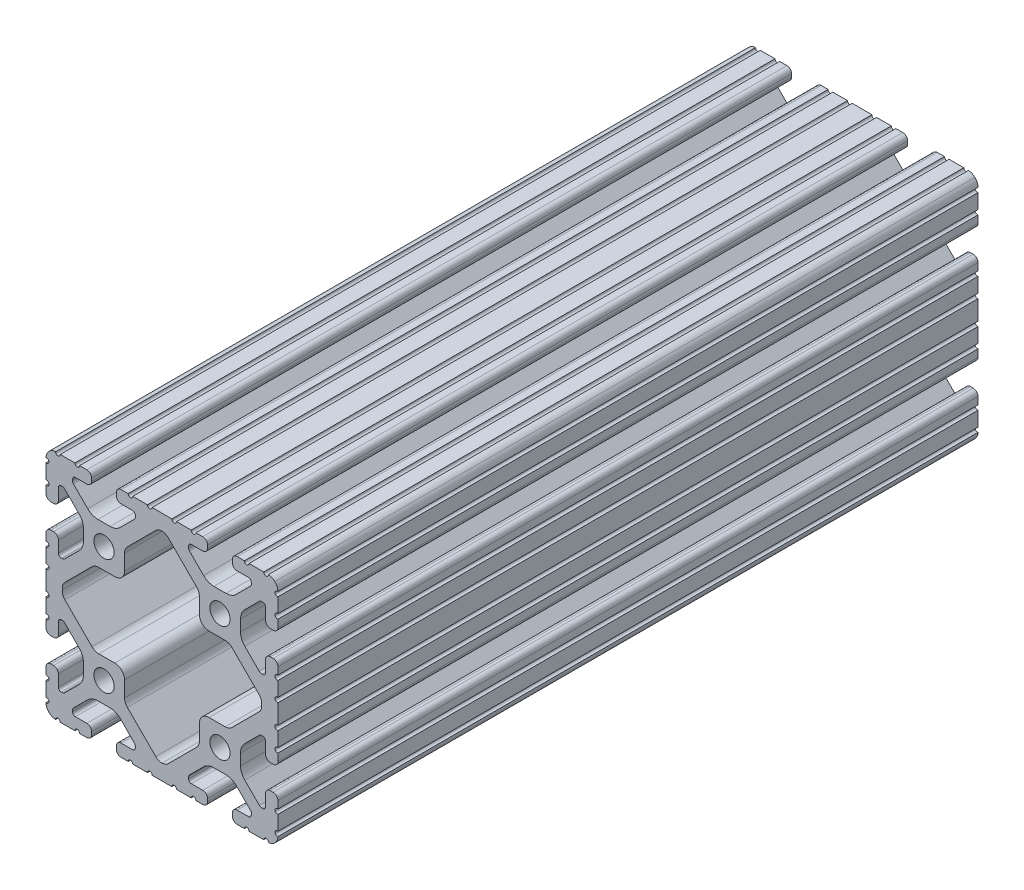
from build123d import *

# Parameters (mm, degrees)
BOSS_EXTRUDE1_DEPTH      = 115
BOSS_EXTRUDE1_DEPTH_BACK = 115
SKETCH3_R                = 3.3274


with BuildPart() as part:
    # Sketch3 → Boss-Extrude1 (new, two sides: drawn at the far end of the back side and taken through both)
    with BuildSketch(Plane.XY.offset(-BOSS_EXTRUDE1_DEPTH_BACK)):
        with BuildLine():
            Line((34.036, 28.448), (34.036, 24.630196049))
            ThreePointArc((34.036, 24.630196049), (34.497248241, 23.51664429), (35.6108, 23.055396049))
            Line((35.6108, 23.055396049), (36.525200183, 23.055396049))
            ThreePointArc((36.525200183, 23.055396049), (37.638751813, 23.516644236), (38.1, 24.630195866))
            Line((38.1, 24.630195866), (38.1, 27.023826138))
            ThreePointArc((38.1, 27.023826138), (37.117780706, 27.7845421), (38.1, 28.545258062))
            Line((38.1, 28.545258062), (38.1, 33.373016026))
            ThreePointArc((38.1, 33.373016026), (37.141472621, 34.109236774), (38.1, 34.845457521))
            ThreePointArc((38.1, 34.845457521), (37.837757813, 36.120195002), (37.086123144, 37.182631793))
            ThreePointArc((37.086123144, 37.182631793), (36.106286572, 37.843374398), (34.952681874, 38.1))
            ThreePointArc((34.952681874, 38.1), (34.190730434, 37.320215335), (33.428778994, 38.1))
            Line((33.428778994, 38.1), (28.601105935, 38.1))
            ThreePointArc((28.601105935, 38.1), (27.839158581, 37.32021942), (27.077211227, 38.1))
            Line((27.077211227, 38.1), (24.6888, 38.1))
            ThreePointArc((24.6888, 38.1), (23.575248241, 37.638751759), (23.114, 36.5252))
            Line((23.114, 36.5252), (23.114, 35.6108))
            ThreePointArc((23.114, 35.6108), (23.575248241, 34.497248241), (24.6888, 34.036))
            Line((24.6888, 34.036), (28.448, 34.036))
            ThreePointArc((28.448, 34.036), (29.076617928, 33.775617928), (29.337, 33.147))
            Line((29.337, 33.147), (29.337, 32.720693454))
            ThreePointArc((29.337, 32.720693454), (29.326675076, 32.273872751), (29.100231244, 31.888543625))
            Line((29.100231244, 31.888543625), (24.409287499, 27.197588341))
            ThreePointArc((24.409287499, 27.197588341), (22.868340045, 26.167958114), (21.050667579, 25.8064))
            Line((21.050667579, 25.8064), (17.049332421, 25.8064))
            ThreePointArc((17.049332421, 25.8064), (15.231659955, 26.167958114), (13.690712501, 27.197588341))
            Line((13.690712501, 27.197588341), (9.023381298, 31.864931024))
            ThreePointArc((9.023381298, 31.864931024), (8.830670886, 32.153343113), (8.763, 32.493548179))
            Line((8.763, 32.493548179), (8.763, 33.147))
            ThreePointArc((8.763, 33.147), (9.023382072, 33.775617928), (9.652, 34.036))
            Line((9.652, 34.036), (13.4112, 34.036))
            ThreePointArc((13.4112, 34.036), (14.524751759, 34.497248241), (14.986, 35.6108))
            Line((14.986, 35.6108), (14.986, 36.5252))
            ThreePointArc((14.986, 36.5252), (14.524751759, 37.638751759), (13.4112, 38.1))
            Line((13.4112, 38.1), (11.128867074, 38.1))
            ThreePointArc((11.128867074, 38.1), (10.367071033, 37.320370693), (9.605274992, 38.1))
            Line((9.605274992, 38.1), (4.777313069, 38.1))
            ThreePointArc((4.777313069, 38.1), (4.015517029, 37.320370693), (3.253720988, 38.1))
            Line((3.253720988, 38.1), (-3.253720988, 38.1))
            ThreePointArc((-3.253720988, 38.1), (-4.015517029, 37.320370693), (-4.777313069, 38.1))
            Line((-4.777313069, 38.1), (-9.605274992, 38.1))
            ThreePointArc((-9.605274992, 38.1), (-10.367071033, 37.320370693), (-11.128867074, 38.1))
            Line((-11.128867074, 38.1), (-13.4112, 38.1))
            ThreePointArc((-13.4112, 38.1), (-14.524751759, 37.638751759), (-14.986, 36.5252))
            Line((-14.986, 36.5252), (-14.986, 35.6108))
            ThreePointArc((-14.986, 35.6108), (-14.524751759, 34.497248241), (-13.4112, 34.036))
            Line((-13.4112, 34.036), (-9.652, 34.036))
            ThreePointArc((-9.652, 34.036), (-9.023382072, 33.775617928), (-8.763, 33.147))
            Line((-8.763, 33.147), (-8.763, 32.493548179))
            ThreePointArc((-8.763, 32.493548179), (-8.830670886, 32.153343113), (-9.023381298, 31.864931024))
            Line((-9.023381298, 31.864931024), (-13.690712501, 27.197588341))
            ThreePointArc((-13.690712501, 27.197588341), (-15.231659955, 26.167958114), (-17.049332421, 25.8064))
            Line((-17.049332421, 25.8064), (-21.050667579, 25.8064))
            ThreePointArc((-21.050667579, 25.8064), (-22.868340045, 26.167958114), (-24.409287499, 27.197588341))
            Line((-24.409287499, 27.197588341), (-29.100231244, 31.888543625))
            ThreePointArc((-29.100231244, 31.888543625), (-29.326675076, 32.273872751), (-29.337, 32.720693454))
            Line((-29.337, 32.720693454), (-29.337, 33.147))
            ThreePointArc((-29.337, 33.147), (-29.076617928, 33.775617928), (-28.448, 34.036))
            Line((-28.448, 34.036), (-24.6888, 34.036))
            ThreePointArc((-24.6888, 34.036), (-23.575248241, 34.497248241), (-23.114, 35.6108))
            Line((-23.114, 35.6108), (-23.114, 36.5252))
            ThreePointArc((-23.114, 36.5252), (-23.575248241, 37.638751759), (-24.6888, 38.1))
            Line((-24.6888, 38.1), (-27.077211227, 38.1))
            ThreePointArc((-27.077211227, 38.1), (-27.839158581, 37.32021942), (-28.601105935, 38.1))
            Line((-28.601105935, 38.1), (-33.428778994, 38.1))
            ThreePointArc((-33.428778994, 38.1), (-34.190730434, 37.320215335), (-34.952681874, 38.1))
            ThreePointArc((-34.952681874, 38.1), (-36.106286572, 37.843374398), (-37.086123144, 37.182631793))
            ThreePointArc((-37.086123144, 37.182631793), (-37.837757813, 36.120195002), (-38.1, 34.845457521))
            ThreePointArc((-38.1, 34.845457521), (-37.141472621, 34.109236774), (-38.1, 33.373016026))
            Line((-38.1, 33.373016026), (-38.1, 28.545258062))
            ThreePointArc((-38.1, 28.545258062), (-37.117780706, 27.7845421), (-38.1, 27.023826138))
            Line((-38.1, 27.023826138), (-38.1, 24.630195866))
            ThreePointArc((-38.1, 24.630195866), (-37.638751813, 23.516644236), (-36.525200183, 23.055396049))
            Line((-36.525200183, 23.055396049), (-35.6108, 23.055396049))
            ThreePointArc((-35.6108, 23.055396049), (-34.497248241, 23.51664429), (-34.036, 24.630196049))
            Line((-34.036, 24.630196049), (-34.036, 28.448))
            ThreePointArc((-34.036, 28.448), (-33.775617928, 29.076617928), (-33.147, 29.337))
            Line((-33.147, 29.337), (-32.664287242, 29.337))
            ThreePointArc((-32.664287242, 29.337), (-32.324081166, 29.269328695), (-32.03566854, 29.076617155))
            Line((-32.03566854, 29.076617155), (-27.19758008, 24.238516795))
            ThreePointArc((-27.19758008, 24.238516795), (-26.167955879, 22.697572205), (-25.8064, 20.879905136))
            Line((-25.8064, 20.879905136), (-25.8064, 17.220094864))
            ThreePointArc((-25.8064, 17.220094864), (-26.167955879, 15.402427795), (-27.19758008, 13.861483205))
            Line((-27.19758008, 13.861483205), (-31.948944541, 9.110107057))
            ThreePointArc((-31.948944541, 9.110107057), (-32.333417096, 8.853210196), (-32.786933649, 8.763))
            Line((-32.786933649, 8.763), (-33.060275787, 8.763))
            ThreePointArc((-33.060275787, 8.763), (-33.750216995, 9.048783005), (-34.036, 9.738724213))
            Line((-34.036, 9.738724213), (-34.036, 13.469803585))
            ThreePointArc((-34.036, 13.469803585), (-34.497248348, 14.583355603), (-35.610800366, 15.044603951))
            Line((-35.610800366, 15.044603951), (-36.5252, 15.044603951))
            ThreePointArc((-36.5252, 15.044603951), (-37.638751759, 14.58335571), (-38.1, 13.469803951))
            Line((-38.1, 13.469803951), (-38.1, 11.075039289))
            ThreePointArc((-38.1, 11.075039289), (-37.117000248, 10.313517272), (-38.1, 9.551995255))
            Line((-38.1, 9.551995255), (-38.1, 4.723759308))
            ThreePointArc((-38.1, 4.723759308), (-37.117000248, 3.962237292), (-38.1, 3.200715275))
            Line((-38.1, 3.200715275), (-38.1, -3.200715275))
            ThreePointArc((-38.1, -3.200715275), (-37.117000248, -3.962237292), (-38.1, -4.723759308))
            Line((-38.1, -4.723759308), (-38.1, -9.551995255))
            ThreePointArc((-38.1, -9.551995255), (-37.117000248, -10.313517272), (-38.1, -11.075039289))
            Line((-38.1, -11.075039289), (-38.1, -13.469803951))
            ThreePointArc((-38.1, -13.469803951), (-37.638751759, -14.58335571), (-36.5252, -15.044603951))
            Line((-36.5252, -15.044603951), (-35.610800366, -15.044603951))
            ThreePointArc((-35.610800366, -15.044603951), (-34.497248348, -14.583355603), (-34.036, -13.469803585))
            Line((-34.036, -13.469803585), (-34.036, -9.738724213))
            ThreePointArc((-34.036, -9.738724213), (-33.750216995, -9.048783005), (-33.060275787, -8.763))
            Line((-33.060275787, -8.763), (-32.786933649, -8.763))
            ThreePointArc((-32.786933649, -8.763), (-32.333417096, -8.853210196), (-31.948944541, -9.110107057))
            Line((-31.948944541, -9.110107057), (-27.19758008, -13.861483205))
            ThreePointArc((-27.19758008, -13.861483205), (-26.167955879, -15.402427795), (-25.8064, -17.220094864))
            Line((-25.8064, -17.220094864), (-25.8064, -20.879905136))
            ThreePointArc((-25.8064, -20.879905136), (-26.167955879, -22.697572205), (-27.19758008, -24.238516795))
            Line((-27.19758008, -24.238516795), (-32.03566854, -29.076617155))
            ThreePointArc((-32.03566854, -29.076617155), (-32.324081166, -29.269328695), (-32.664287242, -29.337))
            Line((-32.664287242, -29.337), (-33.147, -29.337))
            ThreePointArc((-33.147, -29.337), (-33.775617928, -29.076617928), (-34.036, -28.448))
            Line((-34.036, -28.448), (-34.036, -24.630196049))
            ThreePointArc((-34.036, -24.630196049), (-34.497248241, -23.51664429), (-35.6108, -23.055396049))
            Line((-35.6108, -23.055396049), (-36.525200183, -23.055396049))
            ThreePointArc((-36.525200183, -23.055396049), (-37.638751813, -23.516644236), (-38.1, -24.630195866))
            Line((-38.1, -24.630195866), (-38.1, -27.023826138))
            ThreePointArc((-38.1, -27.023826138), (-37.117780706, -27.7845421), (-38.1, -28.545258062))
            Line((-38.1, -28.545258062), (-38.1, -33.373016026))
            ThreePointArc((-38.1, -33.373016026), (-37.141472621, -34.109236774), (-38.1, -34.845457521))
            ThreePointArc((-38.1, -34.845457521), (-37.837757813, -36.120195002), (-37.086123144, -37.182631793))
            ThreePointArc((-37.086123144, -37.182631793), (-36.106286572, -37.843374398), (-34.952681874, -38.1))
            ThreePointArc((-34.952681874, -38.1), (-34.190730434, -37.320215335), (-33.428778994, -38.1))
            Line((-33.428778994, -38.1), (-28.601105935, -38.1))
            ThreePointArc((-28.601105935, -38.1), (-27.839158581, -37.32021942), (-27.077211227, -38.1))
            Line((-27.077211227, -38.1), (-24.6888, -38.1))
            ThreePointArc((-24.6888, -38.1), (-23.575248241, -37.638751759), (-23.114, -36.5252))
            Line((-23.114, -36.5252), (-23.114, -35.6108))
            ThreePointArc((-23.114, -35.6108), (-23.575248241, -34.497248241), (-24.6888, -34.036))
            Line((-24.6888, -34.036), (-28.448, -34.036))
            ThreePointArc((-28.448, -34.036), (-29.076617928, -33.775617928), (-29.337, -33.147))
            Line((-29.337, -33.147), (-29.337, -32.720693454))
            ThreePointArc((-29.337, -32.720693454), (-29.326675076, -32.273872751), (-29.100231244, -31.888543625))
            Line((-29.100231244, -31.888543625), (-24.409287499, -27.197588341))
            ThreePointArc((-24.409287499, -27.197588341), (-22.868340045, -26.167958114), (-21.050667579, -25.8064))
            Line((-21.050667579, -25.8064), (-17.049332421, -25.8064))
            ThreePointArc((-17.049332421, -25.8064), (-15.231659955, -26.167958114), (-13.690712501, -27.197588341))
            Line((-13.690712501, -27.197588341), (-9.023381298, -31.864931024))
            ThreePointArc((-9.023381298, -31.864931024), (-8.830670886, -32.153343113), (-8.763, -32.493548179))
            Line((-8.763, -32.493548179), (-8.763, -33.147))
            ThreePointArc((-8.763, -33.147), (-9.023382072, -33.775617928), (-9.652, -34.036))
            Line((-9.652, -34.036), (-13.4112, -34.036))
            ThreePointArc((-13.4112, -34.036), (-14.524751759, -34.497248241), (-14.986, -35.6108))
            Line((-14.986, -35.6108), (-14.986, -36.5252))
            ThreePointArc((-14.986, -36.5252), (-14.524751759, -37.638751759), (-13.4112, -38.1))
            Line((-13.4112, -38.1), (-11.128867074, -38.1))
            ThreePointArc((-11.128867074, -38.1), (-10.367071033, -37.320370693), (-9.605274992, -38.1))
            Line((-9.605274992, -38.1), (-4.777313069, -38.1))
            ThreePointArc((-4.777313069, -38.1), (-4.015517029, -37.320370693), (-3.253720988, -38.1))
            Line((-3.253720988, -38.1), (3.253720988, -38.1))
            ThreePointArc((3.253720988, -38.1), (4.015517029, -37.320370693), (4.777313069, -38.1))
            Line((4.777313069, -38.1), (9.605274992, -38.1))
            ThreePointArc((9.605274992, -38.1), (10.367071033, -37.320370693), (11.128867074, -38.1))
            Line((11.128867074, -38.1), (13.4112, -38.1))
            ThreePointArc((13.4112, -38.1), (14.524751759, -37.638751759), (14.986, -36.5252))
            Line((14.986, -36.5252), (14.986, -35.6108))
            ThreePointArc((14.986, -35.6108), (14.524751759, -34.497248241), (13.4112, -34.036))
            Line((13.4112, -34.036), (9.652, -34.036))
            ThreePointArc((9.652, -34.036), (9.023382072, -33.775617928), (8.763, -33.147))
            Line((8.763, -33.147), (8.763, -32.493548179))
            ThreePointArc((8.763, -32.493548179), (8.830670886, -32.153343113), (9.023381298, -31.864931024))
            Line((9.023381298, -31.864931024), (13.690712501, -27.197588341))
            ThreePointArc((13.690712501, -27.197588341), (15.231659955, -26.167958114), (17.049332421, -25.8064))
            Line((17.049332421, -25.8064), (21.050667579, -25.8064))
            ThreePointArc((21.050667579, -25.8064), (22.868340045, -26.167958114), (24.409287499, -27.197588341))
            Line((24.409287499, -27.197588341), (29.100231244, -31.888543625))
            ThreePointArc((29.100231244, -31.888543625), (29.326675076, -32.273872751), (29.337, -32.720693454))
            Line((29.337, -32.720693454), (29.337, -33.147))
            ThreePointArc((29.337, -33.147), (29.076617928, -33.775617928), (28.448, -34.036))
            Line((28.448, -34.036), (24.6888, -34.036))
            ThreePointArc((24.6888, -34.036), (23.575248241, -34.497248241), (23.114, -35.6108))
            Line((23.114, -35.6108), (23.114, -36.5252))
            ThreePointArc((23.114, -36.5252), (23.575248241, -37.638751759), (24.6888, -38.1))
            Line((24.6888, -38.1), (27.077211227, -38.1))
            ThreePointArc((27.077211227, -38.1), (27.839158581, -37.32021942), (28.601105935, -38.1))
            Line((28.601105935, -38.1), (33.428778994, -38.1))
            ThreePointArc((33.428778994, -38.1), (34.190730434, -37.320215335), (34.952681874, -38.1))
            ThreePointArc((34.952681874, -38.1), (36.106286572, -37.843374398), (37.086123144, -37.182631793))
            ThreePointArc((37.086123144, -37.182631793), (37.837757813, -36.120195002), (38.1, -34.845457521))
            ThreePointArc((38.1, -34.845457521), (37.141472621, -34.109236774), (38.1, -33.373016026))
            Line((38.1, -33.373016026), (38.1, -28.545258062))
            ThreePointArc((38.1, -28.545258062), (37.117780706, -27.7845421), (38.1, -27.023826138))
            Line((38.1, -27.023826138), (38.1, -24.630195866))
            ThreePointArc((38.1, -24.630195866), (37.638751813, -23.516644236), (36.525200183, -23.055396049))
            Line((36.525200183, -23.055396049), (35.6108, -23.055396049))
            ThreePointArc((35.6108, -23.055396049), (34.497248241, -23.51664429), (34.036, -24.630196049))
            Line((34.036, -24.630196049), (34.036, -28.448))
            ThreePointArc((34.036, -28.448), (33.775617928, -29.076617928), (33.147, -29.337))
            Line((33.147, -29.337), (32.664287242, -29.337))
            ThreePointArc((32.664287242, -29.337), (32.324081166, -29.269328695), (32.03566854, -29.076617155))
            Line((32.03566854, -29.076617155), (27.19758008, -24.238516795))
            ThreePointArc((27.19758008, -24.238516795), (26.167955879, -22.697572205), (25.8064, -20.879905136))
            Line((25.8064, -20.879905136), (25.8064, -17.220094864))
            ThreePointArc((25.8064, -17.220094864), (26.167955879, -15.402427795), (27.19758008, -13.861483205))
            Line((27.19758008, -13.861483205), (31.948944541, -9.110107057))
            ThreePointArc((31.948944541, -9.110107057), (32.333417096, -8.853210196), (32.786933649, -8.763))
            Line((32.786933649, -8.763), (33.060275787, -8.763))
            ThreePointArc((33.060275787, -8.763), (33.750216995, -9.048783005), (34.036, -9.738724213))
            Line((34.036, -9.738724213), (34.036, -13.469803585))
            ThreePointArc((34.036, -13.469803585), (34.497248348, -14.583355603), (35.610800366, -15.044603951))
            Line((35.610800366, -15.044603951), (36.5252, -15.044603951))
            ThreePointArc((36.5252, -15.044603951), (37.638751759, -14.58335571), (38.1, -13.469803951))
            Line((38.1, -13.469803951), (38.1, -11.075039289))
            ThreePointArc((38.1, -11.075039289), (37.117000248, -10.313517272), (38.1, -9.551995255))
            Line((38.1, -9.551995255), (38.1, -4.723759308))
            ThreePointArc((38.1, -4.723759308), (37.117000248, -3.962237292), (38.1, -3.200715275))
            Line((38.1, -3.200715275), (38.1, 3.200715275))
            ThreePointArc((38.1, 3.200715275), (37.117000248, 3.962237292), (38.1, 4.723759308))
            Line((38.1, 4.723759308), (38.1, 9.551995255))
            ThreePointArc((38.1, 9.551995255), (37.117000248, 10.313517272), (38.1, 11.075039289))
            Line((38.1, 11.075039289), (38.1, 13.469803951))
            ThreePointArc((38.1, 13.469803951), (37.638751759, 14.58335571), (36.5252, 15.044603951))
            Line((36.5252, 15.044603951), (35.610800366, 15.044603951))
            ThreePointArc((35.610800366, 15.044603951), (34.497248348, 14.583355603), (34.036, 13.469803585))
            Line((34.036, 13.469803585), (34.036, 9.738724213))
            ThreePointArc((34.036, 9.738724213), (33.750216995, 9.048783005), (33.060275787, 8.763))
            Line((33.060275787, 8.763), (32.786933649, 8.763))
            ThreePointArc((32.786933649, 8.763), (32.333417096, 8.853210196), (31.948944541, 9.110107057))
            Line((31.948944541, 9.110107057), (27.19758008, 13.861483205))
            ThreePointArc((27.19758008, 13.861483205), (26.167955879, 15.402427795), (25.8064, 17.220094864))
            Line((25.8064, 17.220094864), (25.8064, 20.879905136))
            ThreePointArc((25.8064, 20.879905136), (26.167955879, 22.697572205), (27.19758008, 24.238516795))
            Line((27.19758008, 24.238516795), (32.03566854, 29.076617155))
            ThreePointArc((32.03566854, 29.076617155), (32.324081166, 29.269328695), (32.664287242, 29.337))
            Line((32.664287242, 29.337), (33.147, 29.337))
            ThreePointArc((33.147, 29.337), (33.775617928, 29.076617928), (34.036, 28.448))
        make_face()
        with Locations((19.05, 19.05)):
            Circle(SKETCH3_R, mode=Mode.SUBTRACT)
        with Locations((-19.05, 19.05)):
            Circle(SKETCH3_R, mode=Mode.SUBTRACT)
        with Locations((19.05, -19.05)):
            Circle(SKETCH3_R, mode=Mode.SUBTRACT)
        with Locations((-19.05, -19.05)):
            Circle(SKETCH3_R, mode=Mode.SUBTRACT)
        with BuildLine():
            Line((-11.363666791, -22.843321003), (-2.051515952, -32.155494748))
            ThreePointArc((-2.051515952, -32.155494748), (-1.11031328, -32.786013752), (0, -33.011005091))
            ThreePointArc((0, -33.011005091), (1.11031328, -32.786013752), (2.051515952, -32.155494748))
            Line((2.051515952, -32.155494748), (11.363666791, -22.843321003))
            ThreePointArc((11.363666791, -22.843321003), (12.051918263, -21.813277828), (12.2936, -20.598259734))
            Line((12.2936, -20.598259734), (12.2936, -15.4686))
            ThreePointArc((12.2936, -15.4686), (13.22353597, -13.22353597), (15.4686, -12.2936))
            Line((15.4686, -12.2936), (20.769026744, -12.2936))
            ThreePointArc((20.769026744, -12.2936), (21.984048446, -12.051916769), (23.014093535, -11.363661269))
            Line((23.014093535, -11.363661269), (31.902125566, -2.475607377))
            ThreePointArc((31.902125566, -2.475607377), (32.607298578, -1.335259481), (32.728725173, 0))
            ThreePointArc((32.728725173, 0), (32.607298578, 1.335259481), (31.902125566, 2.475607377))
            Line((31.902125566, 2.475607377), (23.014093535, 11.363661269))
            ThreePointArc((23.014093535, 11.363661269), (21.984048446, 12.051916769), (20.769026744, 12.2936))
            Line((20.769026744, 12.2936), (15.4686, 12.2936))
            ThreePointArc((15.4686, 12.2936), (13.22353597, 13.22353597), (12.2936, 15.4686))
            Line((12.2936, 15.4686), (12.2936, 20.598259734))
            ThreePointArc((12.2936, 20.598259734), (12.051918263, 21.813277828), (11.363666791, 22.843321003))
            Line((11.363666791, 22.843321003), (2.051515952, 32.155494748))
            ThreePointArc((2.051515952, 32.155494748), (1.11031328, 32.786013752), (0, 33.011005091))
            ThreePointArc((0, 33.011005091), (-1.11031328, 32.786013752), (-2.051515952, 32.155494748))
            Line((-2.051515952, 32.155494748), (-11.363666791, 22.843321003))
            ThreePointArc((-11.363666791, 22.843321003), (-12.051918263, 21.813277828), (-12.2936, 20.598259734))
            Line((-12.2936, 20.598259734), (-12.2936, 15.4686))
            ThreePointArc((-12.2936, 15.4686), (-13.22353597, 13.22353597), (-15.4686, 12.2936))
            Line((-15.4686, 12.2936), (-20.769026744, 12.2936))
            ThreePointArc((-20.769026744, 12.2936), (-21.984048446, 12.051916769), (-23.014093535, 11.363661269))
            Line((-23.014093535, 11.363661269), (-31.902125566, 2.475607377))
            ThreePointArc((-31.902125566, 2.475607377), (-32.607298578, 1.335259481), (-32.728725173, 0))
            ThreePointArc((-32.728725173, 0), (-32.607298578, -1.335259481), (-31.902125566, -2.475607377))
            Line((-31.902125566, -2.475607377), (-23.014093535, -11.363661269))
            ThreePointArc((-23.014093535, -11.363661269), (-21.984048446, -12.051916769), (-20.769026744, -12.2936))
            Line((-20.769026744, -12.2936), (-15.4686, -12.2936))
            ThreePointArc((-15.4686, -12.2936), (-13.22353597, -13.22353597), (-12.2936, -15.4686))
            Line((-12.2936, -15.4686), (-12.2936, -20.598259734))
            ThreePointArc((-12.2936, -20.598259734), (-12.051918263, -21.813277828), (-11.363666791, -22.843321003))
        make_face(mode=Mode.SUBTRACT)
    extrude(amount=BOSS_EXTRUDE1_DEPTH + BOSS_EXTRUDE1_DEPTH_BACK)


solid = part.part
